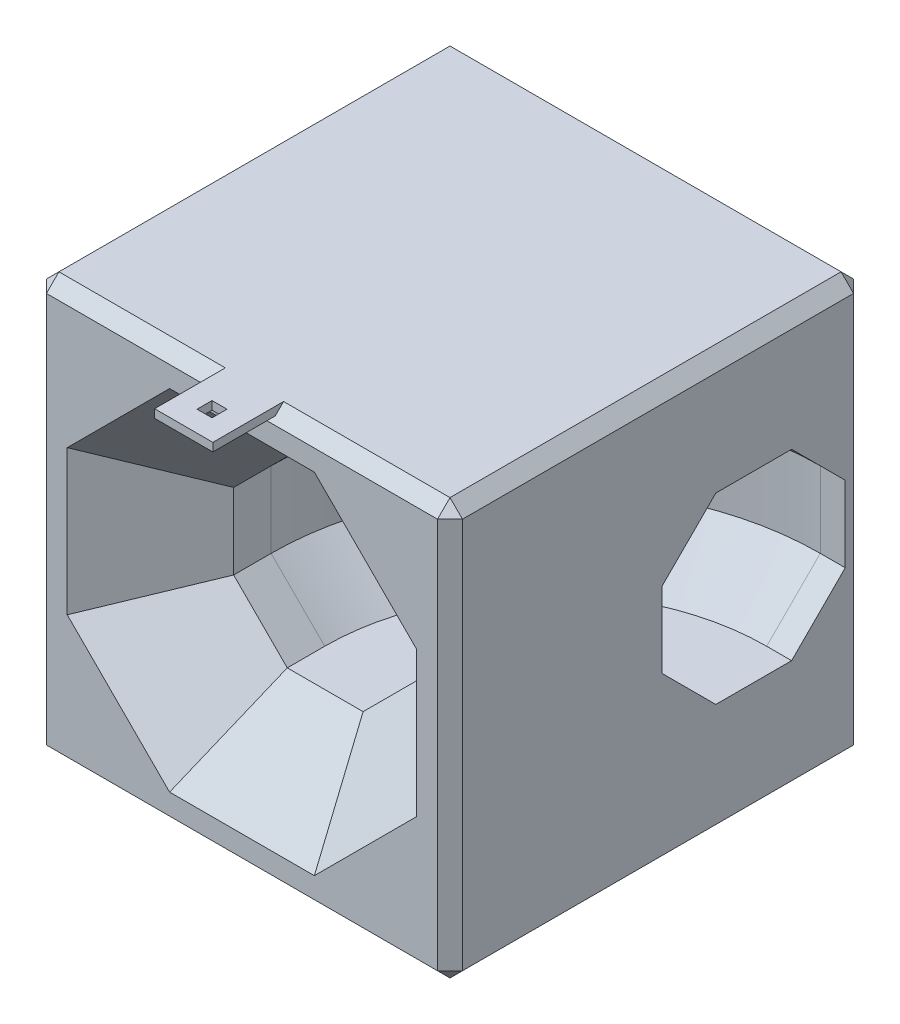
from build123d import *

# Parameters (mm, degrees)
SKETCH1_W                = 50
SKETCH1_H                = 50
BOSS_EXTRUDE1_DEPTH      = 50
CHAMFER1_SIZE            = 10
CHAMFER2_SIZE            = 1.5
BOSS_EXTRUDE2_DEPTH      = 7
BOSS_EXTRUDE2_DEPTH_BACK = 10
SKETCH10_W               = 7
SKETCH10_H               = 1
SKETCH11_W               = 1.8
SKETCH11_H               = 1.8
CUT_EXTRUDE1_DEPTH       = 7


with BuildPart() as part:
    # Sketch1 → Boss-Extrude1 (new body)
    with BuildSketch(Plane.XY):
        with Locations((25, 25)):
            Rectangle(SKETCH1_W, SKETCH1_H)
    extrude(amount=BOSS_EXTRUDE1_DEPTH)

    # Cut-Sweep5: sweep along a path in Sketch9
    with BuildLine(Plane(origin=(0, 25, 0), x_dir=(-1, 0, 0), z_dir=(0, -1, 0))) as cut_sweep5_path:
        Line((-50, -13.5), (-47, -13.5))
        ThreePointArc((-47, -13.5), (-31.443650814, -19.943650814), (-25, -35.5))
        Line((-25, -35.5), (-25, -50))
    # Sketch8 → Cut-Sweep5 (sweep, cut)
    with BuildSketch(Plane(origin=(50, 0, 0), x_dir=(0, 0, -1), z_dir=(1, 0, 0))):
        Polygon((-2.5, 29.556349186), (-8.943650814, 36), (-18.056349186, 36), (-24.5, 29.556349186), (-24.5, 20.443650814), (-18.056349186, 14), (-8.943650814, 14), (-2.5, 20.443650814), align=None)
    sweep(path=cut_sweep5_path.line, mode=Mode.SUBTRACT)

    # Chamfer1
    chamfer1_edges = [part.edges().sort_by_distance(p)[0] for p in [
        (17.221825407, 17.221825407, 50),
        (32.778174593, 17.221825407, 50),
        (36, 25, 50),
        (32.778174593, 32.778174593, 50),
        (17.221825407, 32.778174593, 50),
        (14, 25, 50),
        (25, 14, 50),
        (25, 36, 50),
    ]]
    chamfer(chamfer1_edges, length=CHAMFER1_SIZE)

    # Chamfer2
    chamfer2_edges = [part.edges().sort_by_distance(p)[0] for p in [
        (50, 25, 50),
        (25, 50, 50),
        (0, 25, 50),
        (25, 50, 0),
        (50, 25, 0),
        (25, 0, 0),
        (0, 25, 0),
        (25, 0, 50),
        (0, 50, 25),
        (50, 50, 25),
        (50, 0, 25),
        (0, 0, 25),
    ]]
    chamfer(chamfer2_edges, length=CHAMFER2_SIZE)

    # Sketch10 → Boss-Extrude2 (add, two sides: drawn at the far end of the back side and taken through both)
    with BuildSketch(Plane.XY.offset(50).offset(-BOSS_EXTRUDE2_DEPTH_BACK)):
        with Locations((25, 49.5)):
            Rectangle(SKETCH10_W, SKETCH10_H)
    extrude(amount=BOSS_EXTRUDE2_DEPTH + BOSS_EXTRUDE2_DEPTH_BACK)

    # Sketch11 → Cut-Extrude1 (cut)
    with BuildSketch(Plane.XZ.offset(-49)):
        with Locations((25, 53.6)):
            Rectangle(SKETCH11_W, SKETCH11_H)
    extrude(amount=-CUT_EXTRUDE1_DEPTH, mode=Mode.SUBTRACT)


solid = part.part
